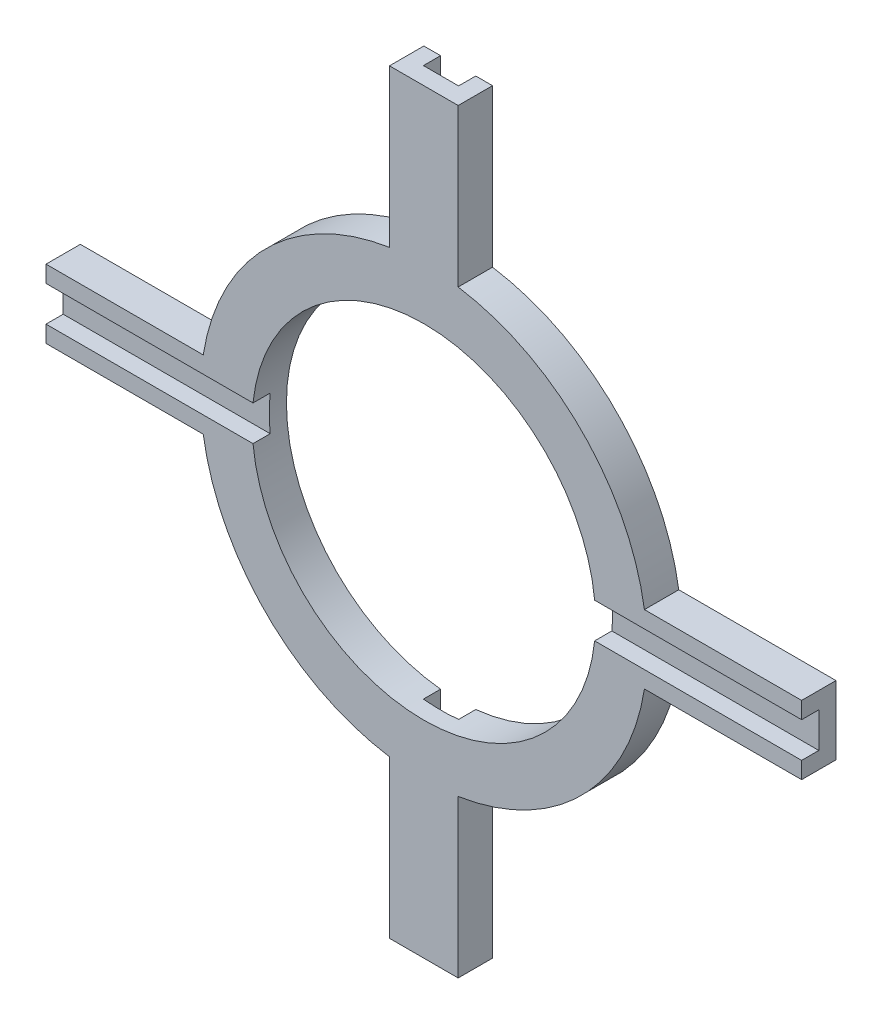
from build123d import *

# Parameters (mm, degrees)
SKETCH1_R                    = 26
SKETCH1_R_2                  = 20
RELIEVED_FLOATING_RING_DEPTH = 4
SKETCH2_W                    = 20
SKETCH2_H                    = 8
X_SLIDE_PAD_1_DEPTH          = 4
SKETCH3_W                    = 8
SKETCH3_H                    = 20
Y_SLIDE_PAD_1_DEPTH          = 4
SKETCH4_W                    = 20
SKETCH4_H                    = 8
X_SLIDE_PAD_1_2_DEPTH        = 4
SKETCH5_W                    = 8
SKETCH5_H                    = 20
Y_SLIDE_PAD_1_2_DEPTH        = 4
SKETCH6_W                    = 4.1
SKETCH6_H                    = 90
LOWER_Y_SLOTS_W4P1_H2_DEPTH  = 2
SKETCH7_W                    = 90
SKETCH7_H                    = 4.1
UPPER_X_SLOTS_W4P1_H2_DEPTH  = 2


with BuildPart() as part:
    # Sketch1 → Relieved_Floating_Ring (new body)
    with BuildSketch(Plane.XY):
        Circle(SKETCH1_R)
        Circle(SKETCH1_R_2, mode=Mode.SUBTRACT)
    extrude(amount=RELIEVED_FLOATING_RING_DEPTH)

    # Sketch2 → X_Slide_Pad_-1 (add)
    with BuildSketch(Plane.XY):
        with Locations((-34, 0)):
            Rectangle(SKETCH2_W, SKETCH2_H)
    extrude(amount=X_SLIDE_PAD_1_DEPTH)

    # Sketch3 → Y_Slide_Pad_-1 (add)
    with BuildSketch(Plane.XY):
        with Locations((0, -34)):
            Rectangle(SKETCH3_W, SKETCH3_H)
    extrude(amount=Y_SLIDE_PAD_1_DEPTH)

    # Sketch4 → X_Slide_Pad_1 2 (add)
    with BuildSketch(Plane.XY):
        with Locations((34, 0)):
            Rectangle(SKETCH4_W, SKETCH4_H)
    extrude(amount=X_SLIDE_PAD_1_2_DEPTH)

    # Sketch5 → Y_Slide_Pad_1 2 (add)
    with BuildSketch(Plane.XY):
        with Locations((0, 34)):
            Rectangle(SKETCH5_W, SKETCH5_H)
    extrude(amount=Y_SLIDE_PAD_1_2_DEPTH)

    # Sketch6 → Lower_Y_Slots_W4p1_H2 (cut)
    with BuildSketch(Plane(origin=(0, 0, 0), x_dir=(-1, 0, 0), z_dir=(0, 0, -1))):
        Rectangle(SKETCH6_W, SKETCH6_H)
    extrude(amount=-LOWER_Y_SLOTS_W4P1_H2_DEPTH, mode=Mode.SUBTRACT)

    # Sketch7 → Upper_X_Slots_W4p1_H2 (cut)
    with BuildSketch(Plane.XY.offset(4)):
        Rectangle(SKETCH7_W, SKETCH7_H)
    extrude(amount=-UPPER_X_SLOTS_W4P1_H2_DEPTH, mode=Mode.SUBTRACT)


solid = part.part
